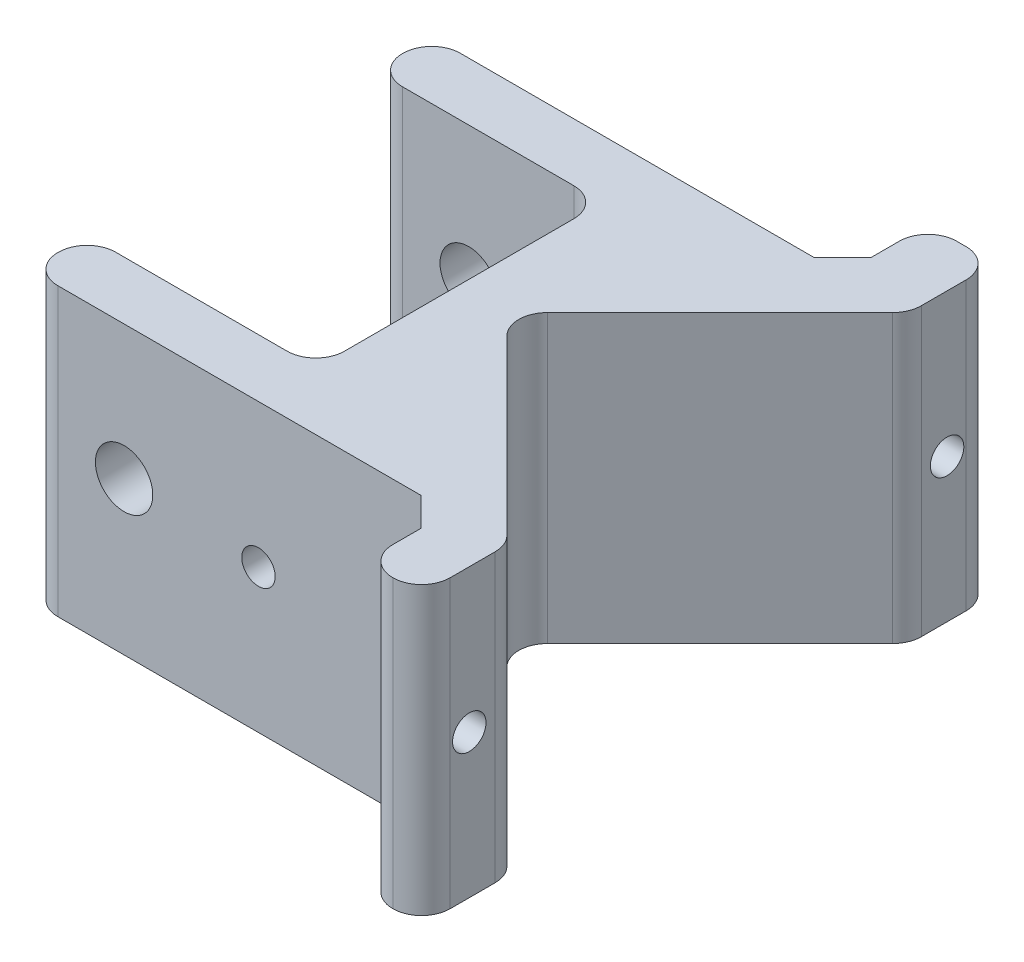
from build123d import *

# Parameters (mm, degrees)
BOSS_EXTRUDE1_DEPTH     = 30
SKETCH2_W               = 30
SKETCH2_H               = 30
CUT_EXTRUDE1_DEPTH      = 30
CHAMFER1_SIZE           = 3
FILLET1_R               = 3
FILLET2_R               = 3
CUT_EXTRUDE2_DEPTH      = 30
CUT_EXTRUDE2_DEPTH_BACK = 30
SKETCH3_R               = 1.75
CUT_EXTRUDE3_DEPTH      = 50
CUT_EXTRUDE3_DEPTH_BACK = 30
SKETCH4_R               = 3
CUT_EXTRUDE4_DEPTH      = 88.933914818
CUT_EXTRUDE4_DEPTH_BACK = 88.933914818
SKETCH5_R               = 1.75


with BuildPart() as part:
    # Sketch1 → Boss-Extrude1 (new body)
    with BuildSketch(Plane(origin=(0, 0, 0), x_dir=(1, 0, 0), z_dir=(0, 1, 0))):
        Polygon((-65, 21.062445841), (-65, -21.062445841), (-21.005807434, -21.062445841), (-21.005807434, -30), (-15, -30), (-15, -21.062445841), (-36.062445841, 0), (-15, 21.062445841), (-15, 30), (-22, 30), (-22, 21.062445841), align=None)
    extrude(amount=BOSS_EXTRUDE1_DEPTH)

    # Sketch2 → Cut-Extrude1 (cut)
    with BuildSketch(Plane(origin=(0, 30, 0), x_dir=(1, 0, 0), z_dir=(0, 1, 0))):
        with Locations((-56.062445841, 0)):
            Rectangle(SKETCH2_W, SKETCH2_H)
    extrude(amount=-CUT_EXTRUDE1_DEPTH, mode=Mode.SUBTRACT)

    # Chamfer1
    chamfer1_edges = [part.edges().sort_by_distance(p)[0] for p in [
        (-21.005807434, 15, 21.062445841),
        (-22, 15, -21.062445841),
    ]]
    chamfer(chamfer1_edges, length=CHAMFER1_SIZE)

    # Fillet1
    fillet1_edges = [part.edges().sort_by_distance(p)[0] for p in [
        (-36.062445841, 15, 0),
        (-15, 15, 21.062445841),
        (-15, 15, -21.062445841),
        (-41.062445841, 15, 15),
        (-41.062445841, 15, -15),
    ]]
    fillet(fillet1_edges, radius=FILLET1_R)

    # Fillet2
    fillet2_edges = [part.edges().sort_by_distance(p)[0] for p in [
        (-15, 15, 30),
        (-21.005807434, 15, 30),
        (-65, 15, 21.062445841),
        (-65, 15, -21.062445841),
        (-22, 15, -30),
        (-15, 15, -30),
        (-65, 15, 15),
        (-65, 15, -15),
    ]]
    fillet(fillet2_edges, radius=FILLET2_R)

    # Sketch3 → Cut-Extrude2 (cut, two sides: drawn at the far end of the back side and taken through both)
    with BuildSketch(Plane.ZY.offset(22).offset(-CUT_EXTRUDE2_DEPTH_BACK)):
        with Locations(Location((-25, 15, 0), (0, 0, 57.605534529))):
            Circle(SKETCH3_R)
        with Locations(Location((25, 15, 0), (0, 0, 122.394465471))):
            Circle(SKETCH3_R)
    extrude(amount=CUT_EXTRUDE2_DEPTH + CUT_EXTRUDE2_DEPTH_BACK, mode=Mode.SUBTRACT)

    # Sketch4 → Cut-Extrude3 (cut, two sides: drawn at the far end of the back side and taken through both)
    with BuildSketch(Plane.XY.offset(-15).offset(-CUT_EXTRUDE3_DEPTH_BACK)):
        with Locations(Location((-55.062445841, 15.983841749, 0), (0, 0, 180))):
            Circle(SKETCH4_R)
    extrude(amount=CUT_EXTRUDE3_DEPTH + CUT_EXTRUDE3_DEPTH_BACK, mode=Mode.SUBTRACT)

    # Sketch5 → Cut-Extrude4 (cut, two sides: drawn at the far end of the back side and taken through both)
    with BuildSketch(Plane(origin=(0, 0, -21.062445841), x_dir=(-1, 0, 0), z_dir=(0, 0, -1)).offset(-CUT_EXTRUDE4_DEPTH_BACK)):
        with Locations((41, 15)):
            Circle(SKETCH5_R)
    extrude(amount=CUT_EXTRUDE4_DEPTH + CUT_EXTRUDE4_DEPTH_BACK, mode=Mode.SUBTRACT)


solid = part.part
